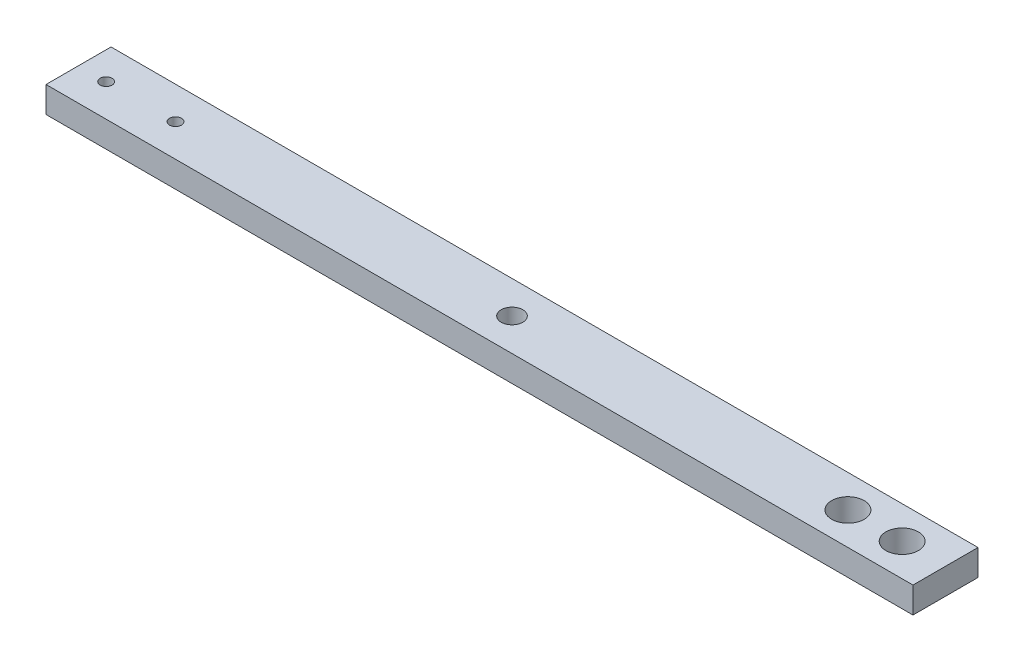
from build123d import *

# Parameters (mm, degrees)
SKETCH1_W           = 400
SKETCH1_H           = 30
SKETCH1_R           = 5
SKETCH1_R_2         = 2.75
BOSS_EXTRUDE1_DEPTH = 12
SKETCH2_R           = 7.5
CUT_EXTRUDE1_DEPTH  = 20


with BuildPart() as part:
    # Sketch1 → Boss-Extrude1 (new body)
    with BuildSketch(Plane(origin=(0, 0, 0), x_dir=(1, 0, 0), z_dir=(0, 1, 0))):
        Rectangle(SKETCH1_W, SKETCH1_H)
        with Locations(Location((0, 0, 0), (0, 0, 270))):
            Circle(SKETCH1_R, mode=Mode.SUBTRACT)
        with Locations(Location((-187.25, 0, 0), (0, 0, 270))):
            Circle(SKETCH1_R_2, mode=Mode.SUBTRACT)
        with Locations(Location((-155.25, 0, 0), (0, 0, 270))):
            Circle(SKETCH1_R_2, mode=Mode.SUBTRACT)
    extrude(amount=BOSS_EXTRUDE1_DEPTH)

    # Sketch2 → Cut-Extrude1 (cut)
    with BuildSketch(Plane(origin=(0, 0, 0), x_dir=(1, 0, 0), z_dir=(0, 1, 0))):
        with Locations(Location((155, 0, 0), (0, 0, 90))):
            Circle(SKETCH2_R)
        with Locations(Location((180, 0, 0), (0, 0, 90))):
            Circle(SKETCH2_R)
    extrude(amount=CUT_EXTRUDE1_DEPTH, mode=Mode.SUBTRACT)


solid = part.part
